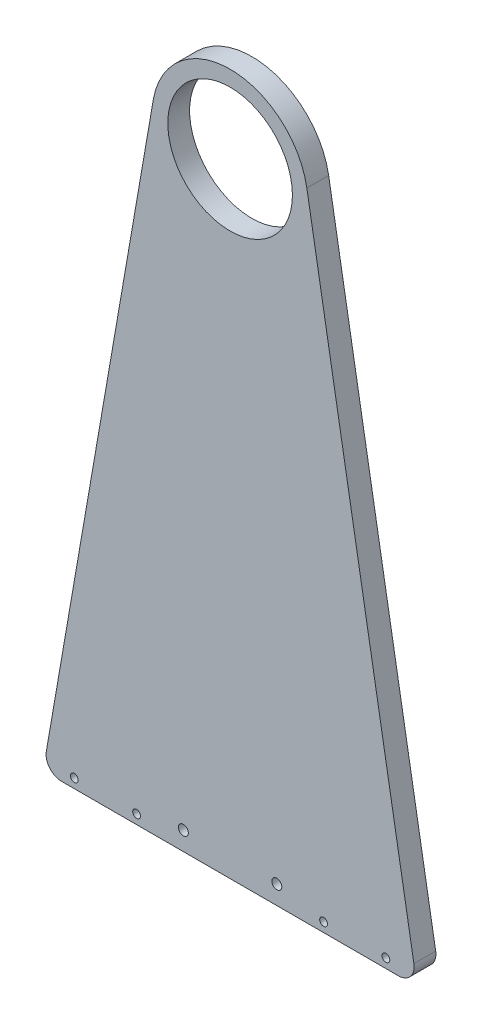
from build123d import *

# Parameters (mm, degrees)
EXTRUDE_1_DEPTH     = 7
SKETCH_2_R          = 20
CUT_EXTRUDE_1_DEPTH = 7
SKETCH_3_R          = 1.6
CUT_EXTRUDE_2_DEPTH = 7
FILLET_1_R          = 5
SKETCH_4_R          = 1.25
CUT_EXTRUDE_3_DEPTH = 10


with BuildPart() as part:
    # 草图1 → 凸台-拉伸1 (new body)
    with BuildSketch(Plane.XY):
        with BuildLine():
            ThreePointArc((-24.633500506, 4.265050152), (0, 25), (24.633500506, 4.265050152))
            Line((24.633500506, 4.265050152), (60, -200))
            Line((60, -200), (-60, -200))
            Line((-60, -200), (-24.633500506, 4.265050152))
        make_face()
    extrude(amount=EXTRUDE_1_DEPTH)

    # 草图2 → 切除-拉伸1 (cut)
    with BuildSketch(Plane.XY.offset(7)):
        Circle(SKETCH_2_R)
    extrude(amount=-CUT_EXTRUDE_1_DEPTH, mode=Mode.SUBTRACT)

    # 草图3 → 切除-拉伸2 (cut)
    with BuildSketch(Plane.XY.offset(7)):
        with Locations((-15.001714002, -194)):
            Circle(SKETCH_3_R)
        with Locations((14.998285998, -194)):
            Circle(SKETCH_3_R)
    extrude(amount=-CUT_EXTRUDE_2_DEPTH, mode=Mode.SUBTRACT)

    # 圆角1
    fillet_1_edges = [part.edges().sort_by_distance(p)[0] for p in [
        (60, -200, 3.5),
        (-60, -200, 3.5),
    ]]
    fillet(fillet_1_edges, radius=FILLET_1_R)

    # 草图4 → 切除-拉伸3 (cut)
    with BuildSketch(Plane.XY.offset(7)):
        with Locations((-50.001714002, -197)):
            Circle(SKETCH_4_R)
        with Locations((-30.001714002, -197)):
            Circle(SKETCH_4_R)
        with Locations((30.001714002, -197)):
            Circle(SKETCH_4_R)
        with Locations((50.001714002, -197)):
            Circle(SKETCH_4_R)
    extrude(amount=-CUT_EXTRUDE_3_DEPTH, mode=Mode.SUBTRACT)


solid = part.part
